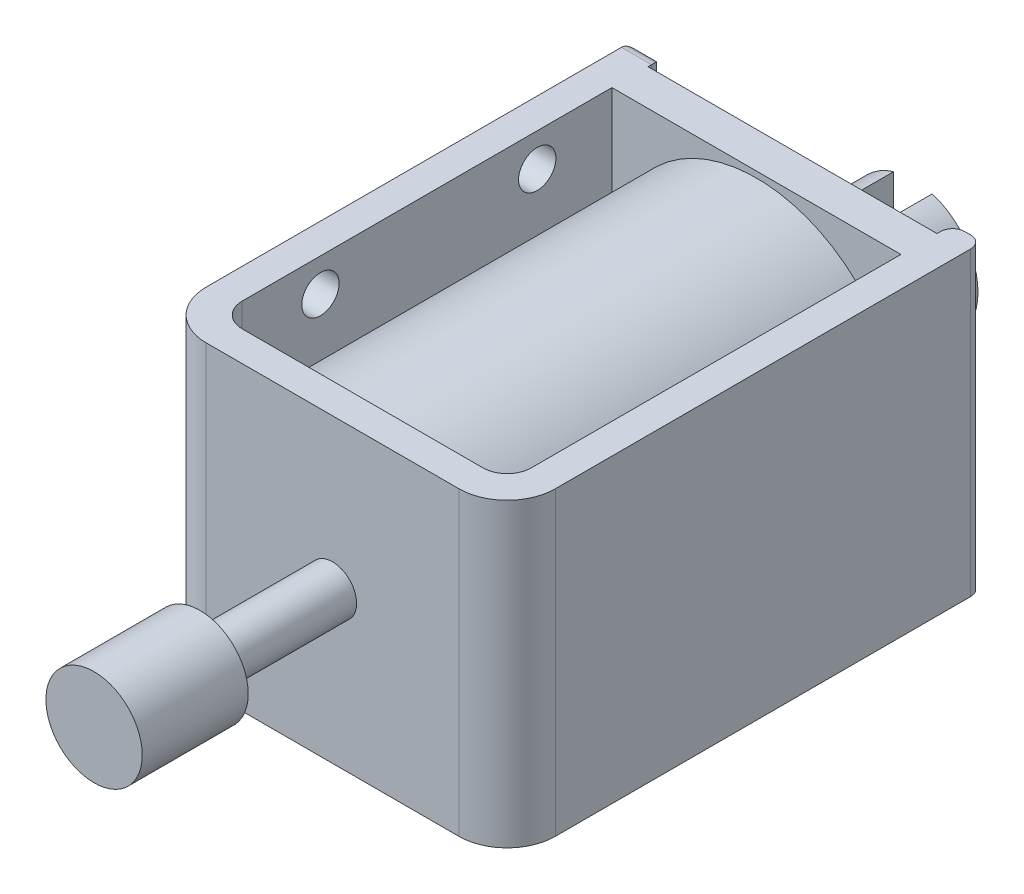
from build123d import *

# Parameters (mm, degrees)
SKETCH1_W               = 24
SKETCH1_H               = 32.703125
BOSS_EXTRUDE1_DEPTH     = 25
SKETCH3_R               = 12
BOSS_EXTRUDE7_DEPTH     = 32.703125
SKETCH4_R               = 2
BOSS_EXTRUDE8_DEPTH     = 11
SKETCH5_R               = 4
BOSS_EXTRUDE9_DEPTH     = 8.8
SKETCH6_R               = 1.55
CUT_EXTRUDE1_DEPTH      = 2.5
SKETCH7_R               = 5.4
BOSS_EXTRUDE10_DEPTH    = 10
CUT_EXTRUDE2_DEPTH      = 9
CUT_EXTRUDE3_DEPTH      = 9
CUT_EXTRUDE3_DEPTH_BACK = 9
SKETCH10_R              = 1.6
FILLET1_R               = 4
FILLET2_R               = 2
FILLET3_R               = 1


with BuildPart() as part:
    # Sketch1 → Boss-Extrude1 (new body)
    with BuildSketch(Plane(origin=(0, 0, 0), x_dir=(1, 0, 0), z_dir=(0, 1, 0))):
        Polygon((-21.109375, 9.19921875), (-18.609375, 9.19921875), (-18.609375, 7.90234375), (5.390625, 7.90234375), (5.390625, 9.19921875), (7.890625, 9.19921875), (7.890625, -30.30078125), (-21.109375, -30.30078125), align=None)
        with Locations((-6.609375, -11.44921875)):
            Rectangle(SKETCH1_W, SKETCH1_H, mode=Mode.SUBTRACT)
    extrude(amount=BOSS_EXTRUDE1_DEPTH)

    # Sketch4 → Boss-Extrude8 (add)
    with BuildSketch(Plane.XY.offset(30.30078125)):
        with Locations(Location((-6.609375, 12.5, 0), (0, 0, 180))):
            Circle(SKETCH4_R)
    extrude(amount=BOSS_EXTRUDE8_DEPTH)

    # Sketch5 → Boss-Extrude9 (add)
    with BuildSketch(Plane.XY.offset(41.30078125)):
        with Locations((-6.609375, 12.5)):
            Circle(SKETCH5_R)
    extrude(amount=BOSS_EXTRUDE9_DEPTH)

    # Sketch6 → Cut-Extrude1 (cut)
    with BuildSketch(Plane.ZY.offset(21.109375)):
        with Locations((1.30078125, 2.75)):
            Circle(SKETCH6_R)
        with Locations((1.30078125, 22.25)):
            Circle(SKETCH6_R)
        with Locations((19.30078125, 22.25)):
            Circle(SKETCH6_R)
        with Locations((19.30078125, 2.75)):
            Circle(SKETCH6_R)
    extrude(amount=-CUT_EXTRUDE1_DEPTH, mode=Mode.SUBTRACT)

    # Sketch7 → Boss-Extrude10 (add)
    with BuildSketch(Plane(origin=(0, 0, -7.90234375), x_dir=(-1, 0, 0), z_dir=(0, 0, -1))):
        with Locations(Location((6.609375, 12.5, 0), (0, 0, 180))):
            Circle(SKETCH7_R)
    extrude(amount=BOSS_EXTRUDE10_DEPTH)

    # Sketch8 → Cut-Extrude2 (cut)
    with BuildSketch(Plane(origin=(0, 0, -17.90234375), x_dir=(-1, 0, 0), z_dir=(0, 0, -1))):
        Polygon((6.609375, 6.57164194), (8.209375, 6.57164194), (8.209375, 21.141508998), (5.009375, 21.141508998), (5.009375, 6.57164194), align=None)
    extrude(amount=-CUT_EXTRUDE2_DEPTH, mode=Mode.SUBTRACT)

    # Sketch10 → Cut-Extrude3 (cut, two sides: drawn at the far end of the back side and taken through both)
    with BuildSketch(Plane.ZY.offset(5.009375).offset(-CUT_EXTRUDE3_DEPTH_BACK)):
        with Locations(Location((-13.90234375, 12.5, 0), (0, 0, 180))):
            Circle(SKETCH10_R)
    extrude(amount=CUT_EXTRUDE3_DEPTH + CUT_EXTRUDE3_DEPTH_BACK, mode=Mode.SUBTRACT)

    # Fillet1
    fillet1_edges = [part.edges().sort_by_distance(p)[0] for p in [
        (7.890625, 12.5, 30.30078125),
        (-21.109375, 12.5, 30.30078125),
    ]]
    fillet(fillet1_edges, radius=FILLET1_R)

    # Fillet2
    fillet2_edges = [part.edges().sort_by_distance(p)[0] for p in [
        (-18.609375, 12.5, 27.80078125),
        (5.390625, 12.5, 27.80078125),
    ]]
    fillet(fillet2_edges, radius=FILLET2_R)

    # Fillet3
    fillet3_edges = [part.edges().sort_by_distance(p)[0] for p in [
        (-18.609375, 12.5, -9.19921875),
        (-19.859375, 25, -9.19921875),
        (-21.109375, 12.5, -9.19921875),
        (-19.859375, 0, -9.19921875),
        (5.390625, 12.5, -9.19921875),
        (7.890625, 12.5, -9.19921875),
    ]]
    fillet(fillet3_edges, radius=FILLET3_R)


with BuildPart() as body_2:
    # Sketch3 → Boss-Extrude7 (new body)
    with BuildSketch(Plane.XY.offset(-4.90234375)):
        with Locations(Location((-6.609375, 12.5, 0), (0, 0, 180))):
            Circle(SKETCH3_R)
    extrude(amount=BOSS_EXTRUDE7_DEPTH)


solid = Compound([part.part, body_2.part])
